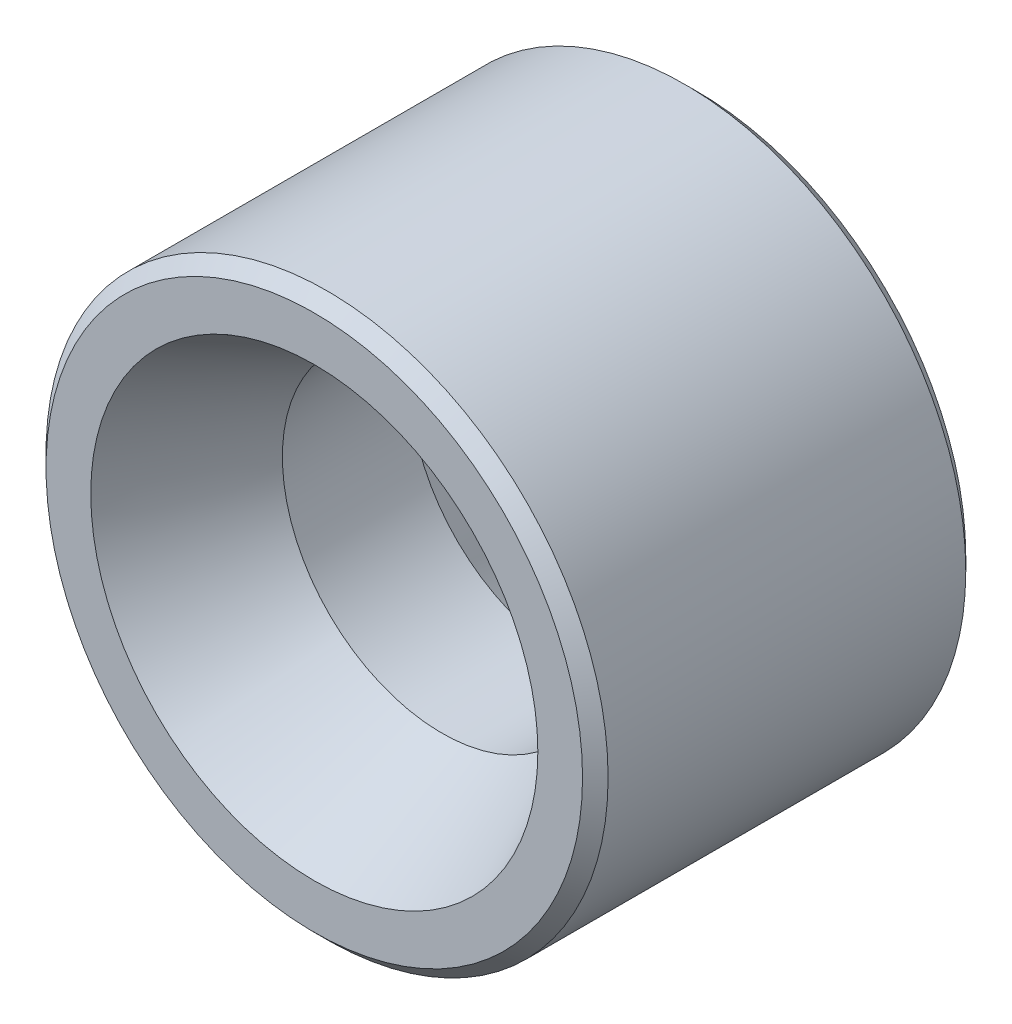
from build123d import *

# Parameters (mm, degrees)
SKETCH1_R           = 22
SKETCH1_R_2         = 12.5
BOSS_EXTRUDE1_DEPTH = 15
CHAMFER1_SIZE       = 1
CHAMFER2_SIZE       = 5
CHAMFER2_SIZE2      = 10
CHAMFER3_SIZE       = 10
CHAMFER3_SIZE2      = 5


with BuildPart() as part:
    # Sketch1 → Boss-Extrude1 (new, symmetric)
    with BuildSketch(Plane.XY):
        Circle(SKETCH1_R)
        Circle(SKETCH1_R_2, mode=Mode.SUBTRACT)
    extrude(amount=BOSS_EXTRUDE1_DEPTH, both=True)

    # Chamfer1
    chamfer1_edges = [part.edges().sort_by_distance(p)[0] for p in [
        (-22, 0, -15),
        (-22, 0, 15),
    ]]
    chamfer(chamfer1_edges, length=CHAMFER1_SIZE)

    # Chamfer2
    chamfer2_edges = [part.edges().sort_by_distance(p)[0] for p in [
        (-12.5, 0, 15),
    ]]
    chamfer2_side = [part.faces().sort_by_distance(p)[0] for p in [
        (-20.406030304, 0, 15),
    ]]
    chamfer(chamfer2_edges, length=CHAMFER2_SIZE, length2=CHAMFER2_SIZE2, reference=chamfer2_side[0])

    # Chamfer3
    chamfer3_edges = [part.edges().sort_by_distance(p)[0] for p in [
        (-12.5, 0, -15),
    ]]
    chamfer3_side = [part.faces().sort_by_distance(p)[0] for p in [
        (-12.5, 0, -5),
    ]]
    chamfer(chamfer3_edges, length=CHAMFER3_SIZE, length2=CHAMFER3_SIZE2, reference=chamfer3_side[0])


solid = part.part
